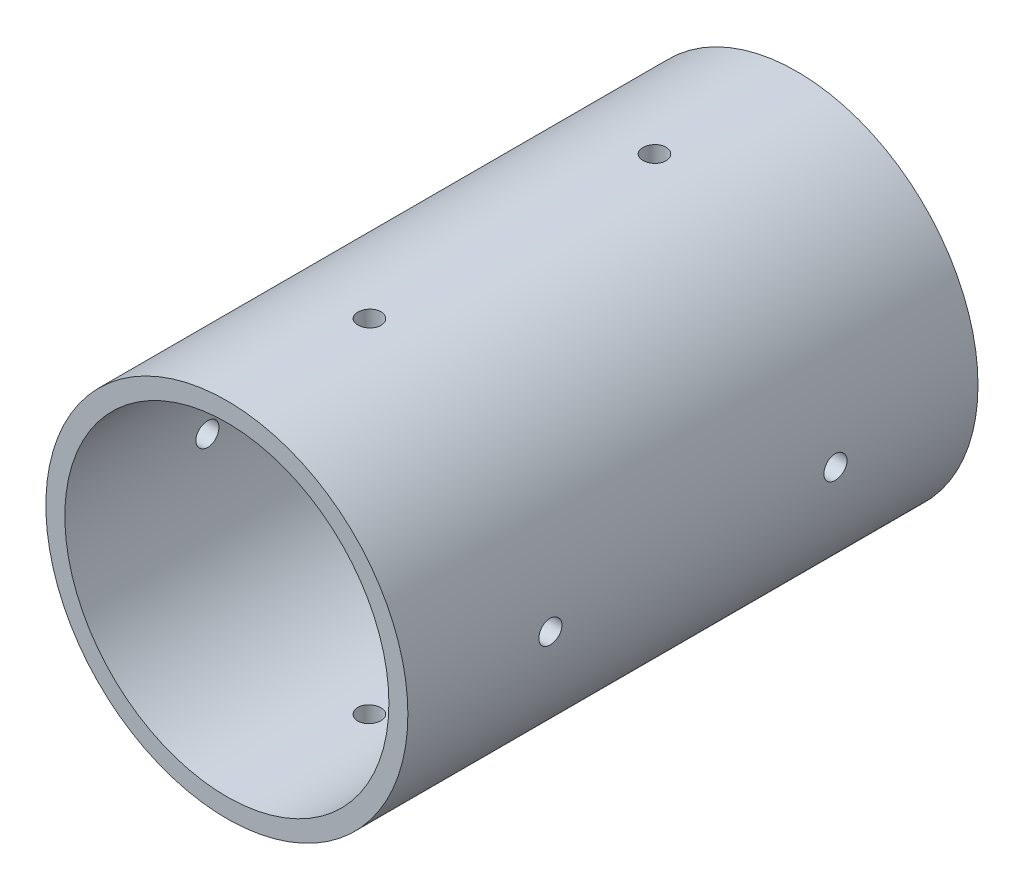
from build123d import *

# Parameters (mm, degrees)
SKETCH1_R                           = 15.875
SKETCH1_R_2                         = 14.210807843
BOSS_EXTRUDE1_DEPTH                 = 50
CUT_EXTRUDE1_REACH                  = 56.809
CUT_EXTRUDE1_END_RADIUS             = 15.875
SKETCH2_R                           = 1.0125
CUT_EXTRUDE1_DIRECTION_2_REACH      = 56.809
CUT_EXTRUDE1_DIRECTION_2_END_RADIUS = 15.875
CUT_EXTRUDE2_REACH                  = 56.809
CUT_EXTRUDE2_END_RADIUS             = 15.875
SKETCH3_R                           = 1.0125
CUT_EXTRUDE2_DIRECTION_2_REACH      = 56.809
CUT_EXTRUDE2_DIRECTION_2_END_RADIUS = 15.875


with BuildPart() as part:
    # Sketch1 → Boss-Extrude1 (new body)
    with BuildSketch(Plane.XY):
        Circle(SKETCH1_R)
        Circle(SKETCH1_R_2, mode=Mode.SUBTRACT)
    extrude(amount=BOSS_EXTRUDE1_DEPTH)

    # Cut-Extrude1: up to this cylinder (the profile starts inside it)
    cut_extrude1_end = Plane(origin=(0, 0, 175), z_dir=(0, 0, -1)) * Cylinder(CUT_EXTRUDE1_END_RADIUS, 471.368, mode=Mode.PRIVATE)
    # Sketch2 → Cut-Extrude1 (cut, up to the surface)
    with BuildSketch(Plane(origin=(0, 0, 0), x_dir=(1, 0, 0), z_dir=(0, 1, 0)), mode=Mode.PRIVATE) as cut_extrude1_sk1:
        with Locations(Location((0, -12.5, 0), (0, 0, 270))):
            Circle(SKETCH2_R)
    cut_extrude1_tool1 = extrude(cut_extrude1_sk1.sketch, amount=-CUT_EXTRUDE1_REACH, mode=Mode.PRIVATE) & cut_extrude1_end
    add(cut_extrude1_tool1.solids().sort_by_distance((0, 0, 12.5))[0], mode=Mode.SUBTRACT)
    # Sketch2 → Cut-Extrude1 (cut, up to the surface)
    with BuildSketch(Plane(origin=(0, 0, 0), x_dir=(1, 0, 0), z_dir=(0, 1, 0)), mode=Mode.PRIVATE) as cut_extrude1_sk2:
        with Locations((0, -312.5)):
            Circle(SKETCH2_R)
    cut_extrude1_tool2 = extrude(cut_extrude1_sk2.sketch, amount=-CUT_EXTRUDE1_REACH, mode=Mode.PRIVATE) & cut_extrude1_end
    add(cut_extrude1_tool2.solids().sort_by_distance((0, 0, 312.5))[0], mode=Mode.SUBTRACT)
    # Sketch2 → Cut-Extrude1 (cut, up to the surface)
    with BuildSketch(Plane(origin=(0, 0, 0), x_dir=(1, 0, 0), z_dir=(0, 1, 0)), mode=Mode.PRIVATE) as cut_extrude1_sk3:
        with Locations(Location((0, -37.5, 0), (0, 0, 270))):
            Circle(SKETCH2_R)
    cut_extrude1_tool3 = extrude(cut_extrude1_sk3.sketch, amount=-CUT_EXTRUDE1_REACH, mode=Mode.PRIVATE) & cut_extrude1_end
    add(cut_extrude1_tool3.solids().sort_by_distance((0, 0, 37.5))[0], mode=Mode.SUBTRACT)
    # Sketch2 → Cut-Extrude1 (cut, up to the surface)
    with BuildSketch(Plane(origin=(0, 0, 0), x_dir=(1, 0, 0), z_dir=(0, 1, 0)), mode=Mode.PRIVATE) as cut_extrude1_sk4:
        with Locations((0, -62.5)):
            Circle(SKETCH2_R)
    cut_extrude1_tool4 = extrude(cut_extrude1_sk4.sketch, amount=-CUT_EXTRUDE1_REACH, mode=Mode.PRIVATE) & cut_extrude1_end
    add(cut_extrude1_tool4.solids().sort_by_distance((0, 0, 62.5))[0], mode=Mode.SUBTRACT)
    # Sketch2 → Cut-Extrude1 (cut, up to the surface)
    with BuildSketch(Plane(origin=(0, 0, 0), x_dir=(1, 0, 0), z_dir=(0, 1, 0)), mode=Mode.PRIVATE) as cut_extrude1_sk5:
        with Locations((0, -87.5)):
            Circle(SKETCH2_R)
    cut_extrude1_tool5 = extrude(cut_extrude1_sk5.sketch, amount=-CUT_EXTRUDE1_REACH, mode=Mode.PRIVATE) & cut_extrude1_end
    add(cut_extrude1_tool5.solids().sort_by_distance((0, 0, 87.5))[0], mode=Mode.SUBTRACT)
    # Sketch2 → Cut-Extrude1 (cut, up to the surface)
    with BuildSketch(Plane(origin=(0, 0, 0), x_dir=(1, 0, 0), z_dir=(0, 1, 0)), mode=Mode.PRIVATE) as cut_extrude1_sk6:
        with Locations((0, -112.5)):
            Circle(SKETCH2_R)
    cut_extrude1_tool6 = extrude(cut_extrude1_sk6.sketch, amount=-CUT_EXTRUDE1_REACH, mode=Mode.PRIVATE) & cut_extrude1_end
    add(cut_extrude1_tool6.solids().sort_by_distance((0, 0, 112.5))[0], mode=Mode.SUBTRACT)
    # Sketch2 → Cut-Extrude1 (cut, up to the surface)
    with BuildSketch(Plane(origin=(0, 0, 0), x_dir=(1, 0, 0), z_dir=(0, 1, 0)), mode=Mode.PRIVATE) as cut_extrude1_sk7:
        with Locations((0, -137.5)):
            Circle(SKETCH2_R)
    cut_extrude1_tool7 = extrude(cut_extrude1_sk7.sketch, amount=-CUT_EXTRUDE1_REACH, mode=Mode.PRIVATE) & cut_extrude1_end
    add(cut_extrude1_tool7.solids().sort_by_distance((0, 0, 137.5))[0], mode=Mode.SUBTRACT)
    # Sketch2 → Cut-Extrude1 (cut, up to the surface)
    with BuildSketch(Plane(origin=(0, 0, 0), x_dir=(1, 0, 0), z_dir=(0, 1, 0)), mode=Mode.PRIVATE) as cut_extrude1_sk8:
        with Locations((0, -162.5)):
            Circle(SKETCH2_R)
    cut_extrude1_tool8 = extrude(cut_extrude1_sk8.sketch, amount=-CUT_EXTRUDE1_REACH, mode=Mode.PRIVATE) & cut_extrude1_end
    add(cut_extrude1_tool8.solids().sort_by_distance((0, 0, 162.5))[0], mode=Mode.SUBTRACT)
    # Sketch2 → Cut-Extrude1 (cut, up to the surface)
    with BuildSketch(Plane(origin=(0, 0, 0), x_dir=(1, 0, 0), z_dir=(0, 1, 0)), mode=Mode.PRIVATE) as cut_extrude1_sk9:
        with Locations((0, -187.5)):
            Circle(SKETCH2_R)
    cut_extrude1_tool9 = extrude(cut_extrude1_sk9.sketch, amount=-CUT_EXTRUDE1_REACH, mode=Mode.PRIVATE) & cut_extrude1_end
    add(cut_extrude1_tool9.solids().sort_by_distance((0, 0, 187.5))[0], mode=Mode.SUBTRACT)
    # Sketch2 → Cut-Extrude1 (cut, up to the surface)
    with BuildSketch(Plane(origin=(0, 0, 0), x_dir=(1, 0, 0), z_dir=(0, 1, 0)), mode=Mode.PRIVATE) as cut_extrude1_sk10:
        with Locations((0, -212.5)):
            Circle(SKETCH2_R)
    cut_extrude1_tool10 = extrude(cut_extrude1_sk10.sketch, amount=-CUT_EXTRUDE1_REACH, mode=Mode.PRIVATE) & cut_extrude1_end
    add(cut_extrude1_tool10.solids().sort_by_distance((0, 0, 212.5))[0], mode=Mode.SUBTRACT)
    # Sketch2 → Cut-Extrude1 (cut, up to the surface)
    with BuildSketch(Plane(origin=(0, 0, 0), x_dir=(1, 0, 0), z_dir=(0, 1, 0)), mode=Mode.PRIVATE) as cut_extrude1_sk11:
        with Locations((0, -237.5)):
            Circle(SKETCH2_R)
    cut_extrude1_tool11 = extrude(cut_extrude1_sk11.sketch, amount=-CUT_EXTRUDE1_REACH, mode=Mode.PRIVATE) & cut_extrude1_end
    add(cut_extrude1_tool11.solids().sort_by_distance((0, 0, 237.5))[0], mode=Mode.SUBTRACT)
    # Sketch2 → Cut-Extrude1 (cut, up to the surface)
    with BuildSketch(Plane(origin=(0, 0, 0), x_dir=(1, 0, 0), z_dir=(0, 1, 0)), mode=Mode.PRIVATE) as cut_extrude1_sk12:
        with Locations((0, -262.5)):
            Circle(SKETCH2_R)
    cut_extrude1_tool12 = extrude(cut_extrude1_sk12.sketch, amount=-CUT_EXTRUDE1_REACH, mode=Mode.PRIVATE) & cut_extrude1_end
    add(cut_extrude1_tool12.solids().sort_by_distance((0, 0, 262.5))[0], mode=Mode.SUBTRACT)
    # Sketch2 → Cut-Extrude1 (cut, up to the surface)
    with BuildSketch(Plane(origin=(0, 0, 0), x_dir=(1, 0, 0), z_dir=(0, 1, 0)), mode=Mode.PRIVATE) as cut_extrude1_sk13:
        with Locations((0, -287.5)):
            Circle(SKETCH2_R)
    cut_extrude1_tool13 = extrude(cut_extrude1_sk13.sketch, amount=-CUT_EXTRUDE1_REACH, mode=Mode.PRIVATE) & cut_extrude1_end
    add(cut_extrude1_tool13.solids().sort_by_distance((0, 0, 287.5))[0], mode=Mode.SUBTRACT)
    # Sketch2 → Cut-Extrude1 (cut, up to the surface)
    with BuildSketch(Plane(origin=(0, 0, 0), x_dir=(1, 0, 0), z_dir=(0, 1, 0)), mode=Mode.PRIVATE) as cut_extrude1_sk14:
        with Locations((0, -337.5)):
            Circle(SKETCH2_R)
    cut_extrude1_tool14 = extrude(cut_extrude1_sk14.sketch, amount=-CUT_EXTRUDE1_REACH, mode=Mode.PRIVATE) & cut_extrude1_end
    add(cut_extrude1_tool14.solids().sort_by_distance((0, 0, 337.5))[0], mode=Mode.SUBTRACT)

    # Cut-Extrude1 direction 2: up to this cylinder (the profile starts inside it)
    cut_extrude1_direction_2_end = Plane(origin=(0, 0, 175), z_dir=(0, 0, -1)) * Cylinder(CUT_EXTRUDE1_DIRECTION_2_END_RADIUS, 471.368, mode=Mode.PRIVATE)
    # Sketch2 → Cut-Extrude1 direction 2 (cut, up to the surface)
    with BuildSketch(Plane(origin=(0, 0, 0), x_dir=(1, 0, 0), z_dir=(0, 1, 0)), mode=Mode.PRIVATE) as cut_extrude1_direction_2_sk1:
        with Locations(Location((0, -12.5, 0), (0, 0, 270))):
            Circle(SKETCH2_R)
    cut_extrude1_direction_2_tool1 = extrude(cut_extrude1_direction_2_sk1.sketch, amount=CUT_EXTRUDE1_DIRECTION_2_REACH, mode=Mode.PRIVATE) & cut_extrude1_direction_2_end
    add(cut_extrude1_direction_2_tool1.solids().sort_by_distance((0, 0, 12.5))[0], mode=Mode.SUBTRACT)
    # Sketch2 → Cut-Extrude1 direction 2 (cut, up to the surface)
    with BuildSketch(Plane(origin=(0, 0, 0), x_dir=(1, 0, 0), z_dir=(0, 1, 0)), mode=Mode.PRIVATE) as cut_extrude1_direction_2_sk2:
        with Locations((0, -312.5)):
            Circle(SKETCH2_R)
    cut_extrude1_direction_2_tool2 = extrude(cut_extrude1_direction_2_sk2.sketch, amount=CUT_EXTRUDE1_DIRECTION_2_REACH, mode=Mode.PRIVATE) & cut_extrude1_direction_2_end
    add(cut_extrude1_direction_2_tool2.solids().sort_by_distance((0, 0, 312.5))[0], mode=Mode.SUBTRACT)
    # Sketch2 → Cut-Extrude1 direction 2 (cut, up to the surface)
    with BuildSketch(Plane(origin=(0, 0, 0), x_dir=(1, 0, 0), z_dir=(0, 1, 0)), mode=Mode.PRIVATE) as cut_extrude1_direction_2_sk3:
        with Locations(Location((0, -37.5, 0), (0, 0, 270))):
            Circle(SKETCH2_R)
    cut_extrude1_direction_2_tool3 = extrude(cut_extrude1_direction_2_sk3.sketch, amount=CUT_EXTRUDE1_DIRECTION_2_REACH, mode=Mode.PRIVATE) & cut_extrude1_direction_2_end
    add(cut_extrude1_direction_2_tool3.solids().sort_by_distance((0, 0, 37.5))[0], mode=Mode.SUBTRACT)
    # Sketch2 → Cut-Extrude1 direction 2 (cut, up to the surface)
    with BuildSketch(Plane(origin=(0, 0, 0), x_dir=(1, 0, 0), z_dir=(0, 1, 0)), mode=Mode.PRIVATE) as cut_extrude1_direction_2_sk4:
        with Locations((0, -62.5)):
            Circle(SKETCH2_R)
    cut_extrude1_direction_2_tool4 = extrude(cut_extrude1_direction_2_sk4.sketch, amount=CUT_EXTRUDE1_DIRECTION_2_REACH, mode=Mode.PRIVATE) & cut_extrude1_direction_2_end
    add(cut_extrude1_direction_2_tool4.solids().sort_by_distance((0, 0, 62.5))[0], mode=Mode.SUBTRACT)
    # Sketch2 → Cut-Extrude1 direction 2 (cut, up to the surface)
    with BuildSketch(Plane(origin=(0, 0, 0), x_dir=(1, 0, 0), z_dir=(0, 1, 0)), mode=Mode.PRIVATE) as cut_extrude1_direction_2_sk5:
        with Locations((0, -87.5)):
            Circle(SKETCH2_R)
    cut_extrude1_direction_2_tool5 = extrude(cut_extrude1_direction_2_sk5.sketch, amount=CUT_EXTRUDE1_DIRECTION_2_REACH, mode=Mode.PRIVATE) & cut_extrude1_direction_2_end
    add(cut_extrude1_direction_2_tool5.solids().sort_by_distance((0, 0, 87.5))[0], mode=Mode.SUBTRACT)
    # Sketch2 → Cut-Extrude1 direction 2 (cut, up to the surface)
    with BuildSketch(Plane(origin=(0, 0, 0), x_dir=(1, 0, 0), z_dir=(0, 1, 0)), mode=Mode.PRIVATE) as cut_extrude1_direction_2_sk6:
        with Locations((0, -112.5)):
            Circle(SKETCH2_R)
    cut_extrude1_direction_2_tool6 = extrude(cut_extrude1_direction_2_sk6.sketch, amount=CUT_EXTRUDE1_DIRECTION_2_REACH, mode=Mode.PRIVATE) & cut_extrude1_direction_2_end
    add(cut_extrude1_direction_2_tool6.solids().sort_by_distance((0, 0, 112.5))[0], mode=Mode.SUBTRACT)
    # Sketch2 → Cut-Extrude1 direction 2 (cut, up to the surface)
    with BuildSketch(Plane(origin=(0, 0, 0), x_dir=(1, 0, 0), z_dir=(0, 1, 0)), mode=Mode.PRIVATE) as cut_extrude1_direction_2_sk7:
        with Locations((0, -137.5)):
            Circle(SKETCH2_R)
    cut_extrude1_direction_2_tool7 = extrude(cut_extrude1_direction_2_sk7.sketch, amount=CUT_EXTRUDE1_DIRECTION_2_REACH, mode=Mode.PRIVATE) & cut_extrude1_direction_2_end
    add(cut_extrude1_direction_2_tool7.solids().sort_by_distance((0, 0, 137.5))[0], mode=Mode.SUBTRACT)
    # Sketch2 → Cut-Extrude1 direction 2 (cut, up to the surface)
    with BuildSketch(Plane(origin=(0, 0, 0), x_dir=(1, 0, 0), z_dir=(0, 1, 0)), mode=Mode.PRIVATE) as cut_extrude1_direction_2_sk8:
        with Locations((0, -162.5)):
            Circle(SKETCH2_R)
    cut_extrude1_direction_2_tool8 = extrude(cut_extrude1_direction_2_sk8.sketch, amount=CUT_EXTRUDE1_DIRECTION_2_REACH, mode=Mode.PRIVATE) & cut_extrude1_direction_2_end
    add(cut_extrude1_direction_2_tool8.solids().sort_by_distance((0, 0, 162.5))[0], mode=Mode.SUBTRACT)
    # Sketch2 → Cut-Extrude1 direction 2 (cut, up to the surface)
    with BuildSketch(Plane(origin=(0, 0, 0), x_dir=(1, 0, 0), z_dir=(0, 1, 0)), mode=Mode.PRIVATE) as cut_extrude1_direction_2_sk9:
        with Locations((0, -187.5)):
            Circle(SKETCH2_R)
    cut_extrude1_direction_2_tool9 = extrude(cut_extrude1_direction_2_sk9.sketch, amount=CUT_EXTRUDE1_DIRECTION_2_REACH, mode=Mode.PRIVATE) & cut_extrude1_direction_2_end
    add(cut_extrude1_direction_2_tool9.solids().sort_by_distance((0, 0, 187.5))[0], mode=Mode.SUBTRACT)
    # Sketch2 → Cut-Extrude1 direction 2 (cut, up to the surface)
    with BuildSketch(Plane(origin=(0, 0, 0), x_dir=(1, 0, 0), z_dir=(0, 1, 0)), mode=Mode.PRIVATE) as cut_extrude1_direction_2_sk10:
        with Locations((0, -212.5)):
            Circle(SKETCH2_R)
    cut_extrude1_direction_2_tool10 = extrude(cut_extrude1_direction_2_sk10.sketch, amount=CUT_EXTRUDE1_DIRECTION_2_REACH, mode=Mode.PRIVATE) & cut_extrude1_direction_2_end
    add(cut_extrude1_direction_2_tool10.solids().sort_by_distance((0, 0, 212.5))[0], mode=Mode.SUBTRACT)
    # Sketch2 → Cut-Extrude1 direction 2 (cut, up to the surface)
    with BuildSketch(Plane(origin=(0, 0, 0), x_dir=(1, 0, 0), z_dir=(0, 1, 0)), mode=Mode.PRIVATE) as cut_extrude1_direction_2_sk11:
        with Locations((0, -237.5)):
            Circle(SKETCH2_R)
    cut_extrude1_direction_2_tool11 = extrude(cut_extrude1_direction_2_sk11.sketch, amount=CUT_EXTRUDE1_DIRECTION_2_REACH, mode=Mode.PRIVATE) & cut_extrude1_direction_2_end
    add(cut_extrude1_direction_2_tool11.solids().sort_by_distance((0, 0, 237.5))[0], mode=Mode.SUBTRACT)
    # Sketch2 → Cut-Extrude1 direction 2 (cut, up to the surface)
    with BuildSketch(Plane(origin=(0, 0, 0), x_dir=(1, 0, 0), z_dir=(0, 1, 0)), mode=Mode.PRIVATE) as cut_extrude1_direction_2_sk12:
        with Locations((0, -262.5)):
            Circle(SKETCH2_R)
    cut_extrude1_direction_2_tool12 = extrude(cut_extrude1_direction_2_sk12.sketch, amount=CUT_EXTRUDE1_DIRECTION_2_REACH, mode=Mode.PRIVATE) & cut_extrude1_direction_2_end
    add(cut_extrude1_direction_2_tool12.solids().sort_by_distance((0, 0, 262.5))[0], mode=Mode.SUBTRACT)
    # Sketch2 → Cut-Extrude1 direction 2 (cut, up to the surface)
    with BuildSketch(Plane(origin=(0, 0, 0), x_dir=(1, 0, 0), z_dir=(0, 1, 0)), mode=Mode.PRIVATE) as cut_extrude1_direction_2_sk13:
        with Locations((0, -287.5)):
            Circle(SKETCH2_R)
    cut_extrude1_direction_2_tool13 = extrude(cut_extrude1_direction_2_sk13.sketch, amount=CUT_EXTRUDE1_DIRECTION_2_REACH, mode=Mode.PRIVATE) & cut_extrude1_direction_2_end
    add(cut_extrude1_direction_2_tool13.solids().sort_by_distance((0, 0, 287.5))[0], mode=Mode.SUBTRACT)
    # Sketch2 → Cut-Extrude1 direction 2 (cut, up to the surface)
    with BuildSketch(Plane(origin=(0, 0, 0), x_dir=(1, 0, 0), z_dir=(0, 1, 0)), mode=Mode.PRIVATE) as cut_extrude1_direction_2_sk14:
        with Locations((0, -337.5)):
            Circle(SKETCH2_R)
    cut_extrude1_direction_2_tool14 = extrude(cut_extrude1_direction_2_sk14.sketch, amount=CUT_EXTRUDE1_DIRECTION_2_REACH, mode=Mode.PRIVATE) & cut_extrude1_direction_2_end
    add(cut_extrude1_direction_2_tool14.solids().sort_by_distance((0, 0, 337.5))[0], mode=Mode.SUBTRACT)

    # Cut-Extrude2: up to this cylinder (the profile starts inside it)
    cut_extrude2_end = Plane(origin=(0, 0, 150), z_dir=(0, 0, -1)) * Cylinder(CUT_EXTRUDE2_END_RADIUS, 421.368, mode=Mode.PRIVATE)
    # Sketch3 → Cut-Extrude2 (cut, up to the surface)
    with BuildSketch(Plane(origin=(0, 0, 0), x_dir=(0, 0, -1), z_dir=(1, 0, 0)), mode=Mode.PRIVATE) as cut_extrude2_sk1:
        with Locations((-12.5, 0)):
            Circle(SKETCH3_R)
    cut_extrude2_tool1 = extrude(cut_extrude2_sk1.sketch, amount=-CUT_EXTRUDE2_REACH, mode=Mode.PRIVATE) & cut_extrude2_end
    add(cut_extrude2_tool1.solids().sort_by_distance((0, 0, 12.5))[0], mode=Mode.SUBTRACT)
    # Sketch3 → Cut-Extrude2 (cut, up to the surface)
    with BuildSketch(Plane(origin=(0, 0, 0), x_dir=(0, 0, -1), z_dir=(1, 0, 0)), mode=Mode.PRIVATE) as cut_extrude2_sk2:
        with Locations((-37.5, 0)):
            Circle(SKETCH3_R)
    cut_extrude2_tool2 = extrude(cut_extrude2_sk2.sketch, amount=-CUT_EXTRUDE2_REACH, mode=Mode.PRIVATE) & cut_extrude2_end
    add(cut_extrude2_tool2.solids().sort_by_distance((0, 0, 37.5))[0], mode=Mode.SUBTRACT)
    # Sketch3 → Cut-Extrude2 (cut, up to the surface)
    with BuildSketch(Plane(origin=(0, 0, 0), x_dir=(0, 0, -1), z_dir=(1, 0, 0)), mode=Mode.PRIVATE) as cut_extrude2_sk3:
        with Locations((-62.5, 0)):
            Circle(SKETCH3_R)
    cut_extrude2_tool3 = extrude(cut_extrude2_sk3.sketch, amount=-CUT_EXTRUDE2_REACH, mode=Mode.PRIVATE) & cut_extrude2_end
    add(cut_extrude2_tool3.solids().sort_by_distance((0, 0, 62.5))[0], mode=Mode.SUBTRACT)
    # Sketch3 → Cut-Extrude2 (cut, up to the surface)
    with BuildSketch(Plane(origin=(0, 0, 0), x_dir=(0, 0, -1), z_dir=(1, 0, 0)), mode=Mode.PRIVATE) as cut_extrude2_sk4:
        with Locations((-87.5, 0)):
            Circle(SKETCH3_R)
    cut_extrude2_tool4 = extrude(cut_extrude2_sk4.sketch, amount=-CUT_EXTRUDE2_REACH, mode=Mode.PRIVATE) & cut_extrude2_end
    add(cut_extrude2_tool4.solids().sort_by_distance((0, 0, 87.5))[0], mode=Mode.SUBTRACT)
    # Sketch3 → Cut-Extrude2 (cut, up to the surface)
    with BuildSketch(Plane(origin=(0, 0, 0), x_dir=(0, 0, -1), z_dir=(1, 0, 0)), mode=Mode.PRIVATE) as cut_extrude2_sk5:
        with Locations((-112.5, 0)):
            Circle(SKETCH3_R)
    cut_extrude2_tool5 = extrude(cut_extrude2_sk5.sketch, amount=-CUT_EXTRUDE2_REACH, mode=Mode.PRIVATE) & cut_extrude2_end
    add(cut_extrude2_tool5.solids().sort_by_distance((0, 0, 112.5))[0], mode=Mode.SUBTRACT)
    # Sketch3 → Cut-Extrude2 (cut, up to the surface)
    with BuildSketch(Plane(origin=(0, 0, 0), x_dir=(0, 0, -1), z_dir=(1, 0, 0)), mode=Mode.PRIVATE) as cut_extrude2_sk6:
        with Locations((-137.5, 0)):
            Circle(SKETCH3_R)
    cut_extrude2_tool6 = extrude(cut_extrude2_sk6.sketch, amount=-CUT_EXTRUDE2_REACH, mode=Mode.PRIVATE) & cut_extrude2_end
    add(cut_extrude2_tool6.solids().sort_by_distance((0, 0, 137.5))[0], mode=Mode.SUBTRACT)
    # Sketch3 → Cut-Extrude2 (cut, up to the surface)
    with BuildSketch(Plane(origin=(0, 0, 0), x_dir=(0, 0, -1), z_dir=(1, 0, 0)), mode=Mode.PRIVATE) as cut_extrude2_sk7:
        with Locations((-162.5, 0)):
            Circle(SKETCH3_R)
    cut_extrude2_tool7 = extrude(cut_extrude2_sk7.sketch, amount=-CUT_EXTRUDE2_REACH, mode=Mode.PRIVATE) & cut_extrude2_end
    add(cut_extrude2_tool7.solids().sort_by_distance((0, 0, 162.5))[0], mode=Mode.SUBTRACT)
    # Sketch3 → Cut-Extrude2 (cut, up to the surface)
    with BuildSketch(Plane(origin=(0, 0, 0), x_dir=(0, 0, -1), z_dir=(1, 0, 0)), mode=Mode.PRIVATE) as cut_extrude2_sk8:
        with Locations((-187.5, 0)):
            Circle(SKETCH3_R)
    cut_extrude2_tool8 = extrude(cut_extrude2_sk8.sketch, amount=-CUT_EXTRUDE2_REACH, mode=Mode.PRIVATE) & cut_extrude2_end
    add(cut_extrude2_tool8.solids().sort_by_distance((0, 0, 187.5))[0], mode=Mode.SUBTRACT)
    # Sketch3 → Cut-Extrude2 (cut, up to the surface)
    with BuildSketch(Plane(origin=(0, 0, 0), x_dir=(0, 0, -1), z_dir=(1, 0, 0)), mode=Mode.PRIVATE) as cut_extrude2_sk9:
        with Locations((-212.5, 0)):
            Circle(SKETCH3_R)
    cut_extrude2_tool9 = extrude(cut_extrude2_sk9.sketch, amount=-CUT_EXTRUDE2_REACH, mode=Mode.PRIVATE) & cut_extrude2_end
    add(cut_extrude2_tool9.solids().sort_by_distance((0, 0, 212.5))[0], mode=Mode.SUBTRACT)
    # Sketch3 → Cut-Extrude2 (cut, up to the surface)
    with BuildSketch(Plane(origin=(0, 0, 0), x_dir=(0, 0, -1), z_dir=(1, 0, 0)), mode=Mode.PRIVATE) as cut_extrude2_sk10:
        with Locations((-237.5, 0)):
            Circle(SKETCH3_R)
    cut_extrude2_tool10 = extrude(cut_extrude2_sk10.sketch, amount=-CUT_EXTRUDE2_REACH, mode=Mode.PRIVATE) & cut_extrude2_end
    add(cut_extrude2_tool10.solids().sort_by_distance((0, 0, 237.5))[0], mode=Mode.SUBTRACT)
    # Sketch3 → Cut-Extrude2 (cut, up to the surface)
    with BuildSketch(Plane(origin=(0, 0, 0), x_dir=(0, 0, -1), z_dir=(1, 0, 0)), mode=Mode.PRIVATE) as cut_extrude2_sk11:
        with Locations((-262.5, 0)):
            Circle(SKETCH3_R)
    cut_extrude2_tool11 = extrude(cut_extrude2_sk11.sketch, amount=-CUT_EXTRUDE2_REACH, mode=Mode.PRIVATE) & cut_extrude2_end
    add(cut_extrude2_tool11.solids().sort_by_distance((0, 0, 262.5))[0], mode=Mode.SUBTRACT)
    # Sketch3 → Cut-Extrude2 (cut, up to the surface)
    with BuildSketch(Plane(origin=(0, 0, 0), x_dir=(0, 0, -1), z_dir=(1, 0, 0)), mode=Mode.PRIVATE) as cut_extrude2_sk12:
        with Locations((-287.5, 0)):
            Circle(SKETCH3_R)
    cut_extrude2_tool12 = extrude(cut_extrude2_sk12.sketch, amount=-CUT_EXTRUDE2_REACH, mode=Mode.PRIVATE) & cut_extrude2_end
    add(cut_extrude2_tool12.solids().sort_by_distance((0, 0, 287.5))[0], mode=Mode.SUBTRACT)

    # Cut-Extrude2 direction 2: up to this cylinder (the profile starts inside it)
    cut_extrude2_direction_2_end = Plane(origin=(0, 0, 150), z_dir=(0, 0, -1)) * Cylinder(CUT_EXTRUDE2_DIRECTION_2_END_RADIUS, 421.368, mode=Mode.PRIVATE)
    # Sketch3 → Cut-Extrude2 direction 2 (cut, up to the surface)
    with BuildSketch(Plane(origin=(0, 0, 0), x_dir=(0, 0, -1), z_dir=(1, 0, 0)), mode=Mode.PRIVATE) as cut_extrude2_direction_2_sk1:
        with Locations((-12.5, 0)):
            Circle(SKETCH3_R)
    cut_extrude2_direction_2_tool1 = extrude(cut_extrude2_direction_2_sk1.sketch, amount=CUT_EXTRUDE2_DIRECTION_2_REACH, mode=Mode.PRIVATE) & cut_extrude2_direction_2_end
    add(cut_extrude2_direction_2_tool1.solids().sort_by_distance((0, 0, 12.5))[0], mode=Mode.SUBTRACT)
    # Sketch3 → Cut-Extrude2 direction 2 (cut, up to the surface)
    with BuildSketch(Plane(origin=(0, 0, 0), x_dir=(0, 0, -1), z_dir=(1, 0, 0)), mode=Mode.PRIVATE) as cut_extrude2_direction_2_sk2:
        with Locations((-37.5, 0)):
            Circle(SKETCH3_R)
    cut_extrude2_direction_2_tool2 = extrude(cut_extrude2_direction_2_sk2.sketch, amount=CUT_EXTRUDE2_DIRECTION_2_REACH, mode=Mode.PRIVATE) & cut_extrude2_direction_2_end
    add(cut_extrude2_direction_2_tool2.solids().sort_by_distance((0, 0, 37.5))[0], mode=Mode.SUBTRACT)
    # Sketch3 → Cut-Extrude2 direction 2 (cut, up to the surface)
    with BuildSketch(Plane(origin=(0, 0, 0), x_dir=(0, 0, -1), z_dir=(1, 0, 0)), mode=Mode.PRIVATE) as cut_extrude2_direction_2_sk3:
        with Locations((-62.5, 0)):
            Circle(SKETCH3_R)
    cut_extrude2_direction_2_tool3 = extrude(cut_extrude2_direction_2_sk3.sketch, amount=CUT_EXTRUDE2_DIRECTION_2_REACH, mode=Mode.PRIVATE) & cut_extrude2_direction_2_end
    add(cut_extrude2_direction_2_tool3.solids().sort_by_distance((0, 0, 62.5))[0], mode=Mode.SUBTRACT)
    # Sketch3 → Cut-Extrude2 direction 2 (cut, up to the surface)
    with BuildSketch(Plane(origin=(0, 0, 0), x_dir=(0, 0, -1), z_dir=(1, 0, 0)), mode=Mode.PRIVATE) as cut_extrude2_direction_2_sk4:
        with Locations((-87.5, 0)):
            Circle(SKETCH3_R)
    cut_extrude2_direction_2_tool4 = extrude(cut_extrude2_direction_2_sk4.sketch, amount=CUT_EXTRUDE2_DIRECTION_2_REACH, mode=Mode.PRIVATE) & cut_extrude2_direction_2_end
    add(cut_extrude2_direction_2_tool4.solids().sort_by_distance((0, 0, 87.5))[0], mode=Mode.SUBTRACT)
    # Sketch3 → Cut-Extrude2 direction 2 (cut, up to the surface)
    with BuildSketch(Plane(origin=(0, 0, 0), x_dir=(0, 0, -1), z_dir=(1, 0, 0)), mode=Mode.PRIVATE) as cut_extrude2_direction_2_sk5:
        with Locations((-112.5, 0)):
            Circle(SKETCH3_R)
    cut_extrude2_direction_2_tool5 = extrude(cut_extrude2_direction_2_sk5.sketch, amount=CUT_EXTRUDE2_DIRECTION_2_REACH, mode=Mode.PRIVATE) & cut_extrude2_direction_2_end
    add(cut_extrude2_direction_2_tool5.solids().sort_by_distance((0, 0, 112.5))[0], mode=Mode.SUBTRACT)
    # Sketch3 → Cut-Extrude2 direction 2 (cut, up to the surface)
    with BuildSketch(Plane(origin=(0, 0, 0), x_dir=(0, 0, -1), z_dir=(1, 0, 0)), mode=Mode.PRIVATE) as cut_extrude2_direction_2_sk6:
        with Locations((-137.5, 0)):
            Circle(SKETCH3_R)
    cut_extrude2_direction_2_tool6 = extrude(cut_extrude2_direction_2_sk6.sketch, amount=CUT_EXTRUDE2_DIRECTION_2_REACH, mode=Mode.PRIVATE) & cut_extrude2_direction_2_end
    add(cut_extrude2_direction_2_tool6.solids().sort_by_distance((0, 0, 137.5))[0], mode=Mode.SUBTRACT)
    # Sketch3 → Cut-Extrude2 direction 2 (cut, up to the surface)
    with BuildSketch(Plane(origin=(0, 0, 0), x_dir=(0, 0, -1), z_dir=(1, 0, 0)), mode=Mode.PRIVATE) as cut_extrude2_direction_2_sk7:
        with Locations((-162.5, 0)):
            Circle(SKETCH3_R)
    cut_extrude2_direction_2_tool7 = extrude(cut_extrude2_direction_2_sk7.sketch, amount=CUT_EXTRUDE2_DIRECTION_2_REACH, mode=Mode.PRIVATE) & cut_extrude2_direction_2_end
    add(cut_extrude2_direction_2_tool7.solids().sort_by_distance((0, 0, 162.5))[0], mode=Mode.SUBTRACT)
    # Sketch3 → Cut-Extrude2 direction 2 (cut, up to the surface)
    with BuildSketch(Plane(origin=(0, 0, 0), x_dir=(0, 0, -1), z_dir=(1, 0, 0)), mode=Mode.PRIVATE) as cut_extrude2_direction_2_sk8:
        with Locations((-187.5, 0)):
            Circle(SKETCH3_R)
    cut_extrude2_direction_2_tool8 = extrude(cut_extrude2_direction_2_sk8.sketch, amount=CUT_EXTRUDE2_DIRECTION_2_REACH, mode=Mode.PRIVATE) & cut_extrude2_direction_2_end
    add(cut_extrude2_direction_2_tool8.solids().sort_by_distance((0, 0, 187.5))[0], mode=Mode.SUBTRACT)
    # Sketch3 → Cut-Extrude2 direction 2 (cut, up to the surface)
    with BuildSketch(Plane(origin=(0, 0, 0), x_dir=(0, 0, -1), z_dir=(1, 0, 0)), mode=Mode.PRIVATE) as cut_extrude2_direction_2_sk9:
        with Locations((-212.5, 0)):
            Circle(SKETCH3_R)
    cut_extrude2_direction_2_tool9 = extrude(cut_extrude2_direction_2_sk9.sketch, amount=CUT_EXTRUDE2_DIRECTION_2_REACH, mode=Mode.PRIVATE) & cut_extrude2_direction_2_end
    add(cut_extrude2_direction_2_tool9.solids().sort_by_distance((0, 0, 212.5))[0], mode=Mode.SUBTRACT)
    # Sketch3 → Cut-Extrude2 direction 2 (cut, up to the surface)
    with BuildSketch(Plane(origin=(0, 0, 0), x_dir=(0, 0, -1), z_dir=(1, 0, 0)), mode=Mode.PRIVATE) as cut_extrude2_direction_2_sk10:
        with Locations((-237.5, 0)):
            Circle(SKETCH3_R)
    cut_extrude2_direction_2_tool10 = extrude(cut_extrude2_direction_2_sk10.sketch, amount=CUT_EXTRUDE2_DIRECTION_2_REACH, mode=Mode.PRIVATE) & cut_extrude2_direction_2_end
    add(cut_extrude2_direction_2_tool10.solids().sort_by_distance((0, 0, 237.5))[0], mode=Mode.SUBTRACT)
    # Sketch3 → Cut-Extrude2 direction 2 (cut, up to the surface)
    with BuildSketch(Plane(origin=(0, 0, 0), x_dir=(0, 0, -1), z_dir=(1, 0, 0)), mode=Mode.PRIVATE) as cut_extrude2_direction_2_sk11:
        with Locations((-262.5, 0)):
            Circle(SKETCH3_R)
    cut_extrude2_direction_2_tool11 = extrude(cut_extrude2_direction_2_sk11.sketch, amount=CUT_EXTRUDE2_DIRECTION_2_REACH, mode=Mode.PRIVATE) & cut_extrude2_direction_2_end
    add(cut_extrude2_direction_2_tool11.solids().sort_by_distance((0, 0, 262.5))[0], mode=Mode.SUBTRACT)
    # Sketch3 → Cut-Extrude2 direction 2 (cut, up to the surface)
    with BuildSketch(Plane(origin=(0, 0, 0), x_dir=(0, 0, -1), z_dir=(1, 0, 0)), mode=Mode.PRIVATE) as cut_extrude2_direction_2_sk12:
        with Locations((-287.5, 0)):
            Circle(SKETCH3_R)
    cut_extrude2_direction_2_tool12 = extrude(cut_extrude2_direction_2_sk12.sketch, amount=CUT_EXTRUDE2_DIRECTION_2_REACH, mode=Mode.PRIVATE) & cut_extrude2_direction_2_end
    add(cut_extrude2_direction_2_tool12.solids().sort_by_distance((0, 0, 287.5))[0], mode=Mode.SUBTRACT)


solid = part.part
